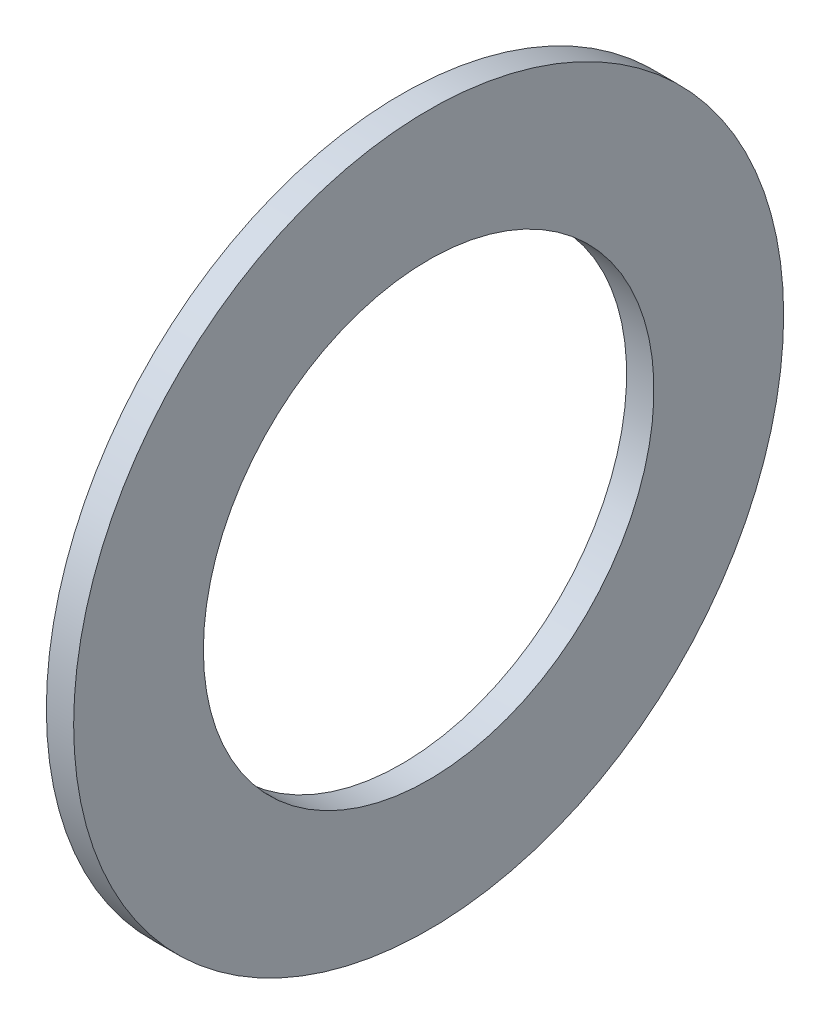
from build123d import *

# Parameters (mm, degrees)
SKETCH1_W = 1
SKETCH1_H = 4.75


with BuildPart() as part:
    # Sketch1 → Base-Revolve (revolve)
    with BuildSketch(Plane.XY, mode=Mode.PRIVATE) as base_revolve_sk:
        with Locations((-0.5, 10.625)):
            Rectangle(SKETCH1_W, SKETCH1_H)
    revolve(base_revolve_sk.sketch.rotate(Axis((-34.925, 0, 0), (1, 0, 0)), 90), axis=Axis((-34.925, 0, 0), (1, 0, 0)))


solid = part.part
